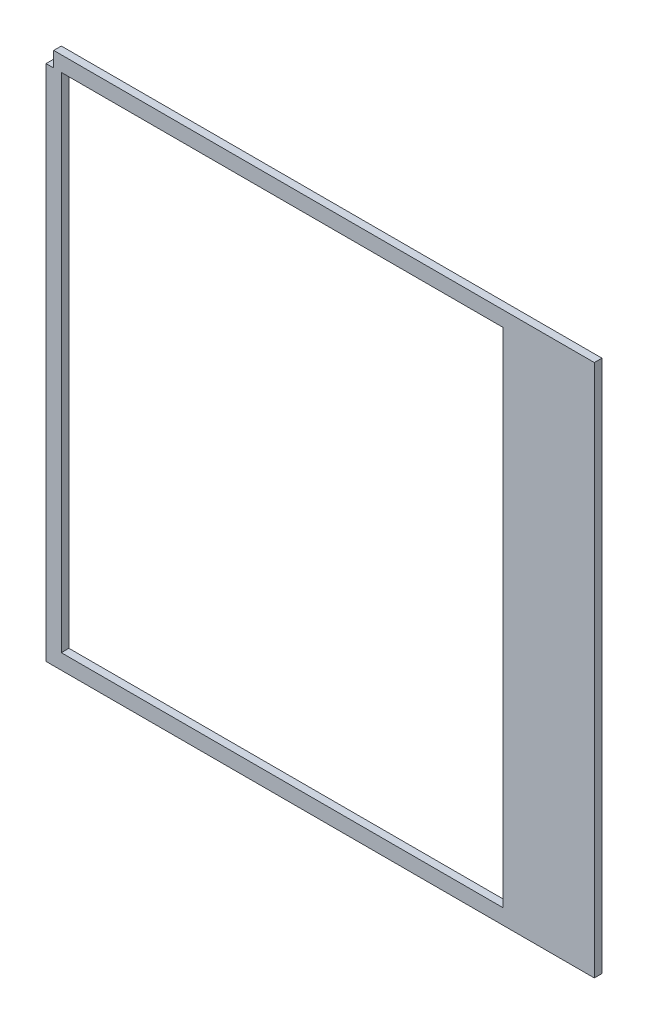
from build123d import *

# Parameters (mm, degrees)
CROQUIS1_W              = 290
CROQUIS1_H              = 330
SALIENTE_EXTRUIR1_DEPTH = 5


with BuildPart() as part:
    # Croquis1 → Saliente-Extruir1 (new body)
    with BuildSketch(Plane.XY):
        Polygon((-156.514277167, 244.450688952), (198.485722833, 244.450688952), (198.485722833, -105.549311048), (-161.514277167, -105.549311048), (-161.514277167, 234.450688952), (-156.514277167, 234.450688952), align=None)
        with Locations((-6.514277167, 69.450688952)):
            Rectangle(CROQUIS1_W, CROQUIS1_H, mode=Mode.SUBTRACT)
    extrude(amount=SALIENTE_EXTRUIR1_DEPTH)


solid = part.part
